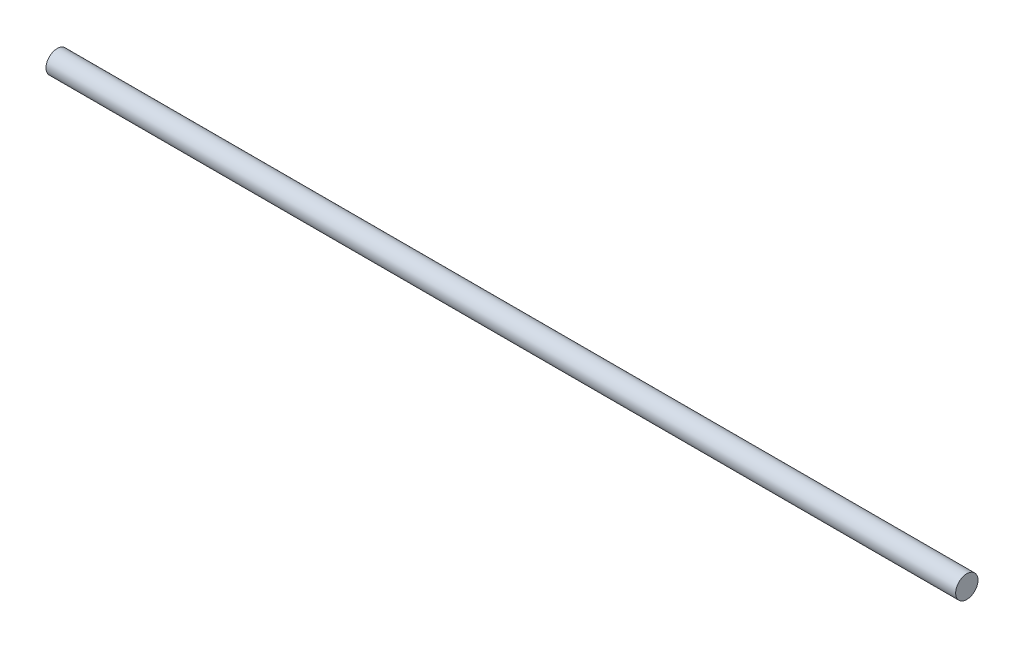
from build123d import *

# Parameters (mm, degrees)
BOSS_EXTRUDE1_DEPTH      = 50
BOSS_EXTRUDE1_DEPTH_BACK = 11
SKETCH1_R                = 0.75


with BuildPart() as part:
    # Sketch1 → Boss-Extrude1 (new, two sides: drawn at the far end of the back side and taken through both)
    with BuildSketch(Plane(origin=(0, 0, 0), x_dir=(0, 0, -1), z_dir=(1, 0, 0)).offset(-BOSS_EXTRUDE1_DEPTH_BACK)):
        Circle(SKETCH1_R)
    extrude(amount=BOSS_EXTRUDE1_DEPTH + BOSS_EXTRUDE1_DEPTH_BACK)


solid = part.part
